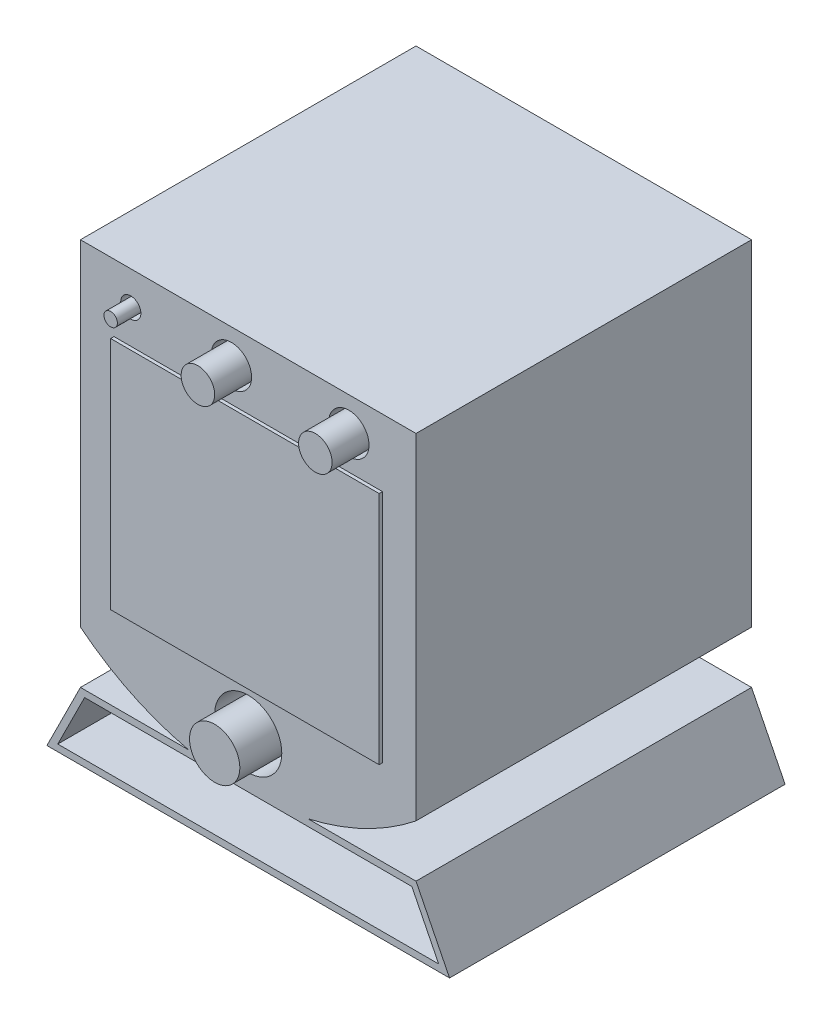
from build123d import *

# Parameters (mm, degrees)
EXTRUDE_1_DEPTH     = 50
EXTRUDE_1_2_DEPTH   = 50
SKETCH_3_W          = 80
SKETCH_3_H          = 70
EXTRUDE_2_DEPTH     = 1
SKETCH_4_R          = 3
SKETCH_4_R_2        = 6
SKETCH_4_R_3        = 10
CUT_EXTRUDE_1_DEPTH = 10
SKETCH_5_R          = 7.5
SKETCH_5_R_2        = 5
EXTRUDE_3_DEPTH     = 20
SKETCH_6_R          = 2
EXTRUDE_4_DEPTH     = 16


with BuildPart() as part:
    # 草图1 → Extrude 1 (new, symmetric)
    with BuildSketch(Plane.XY):
        Polygon((-50, 10.796505179), (50, 10.796505179), (60, -9.203494821), (-60, -9.203494821), align=None)
        Polygon((-48.763932023, 8.796505179), (48.763932023, 8.796505179), (56.763932023, -7.203494821), (-56.763932023, -7.203494821), align=None, mode=Mode.SUBTRACT)
    extrude(amount=EXTRUDE_1_DEPTH, both=True)

    # 草图2 → Extrude 1 2 (add, symmetric)
    with BuildSketch(Plane.XY):
        with BuildLine():
            Line((50, 26.346525195), (50, 126.346525195))
            Line((50, 126.346525195), (-50, 126.346525195))
            Line((-50, 126.346525195), (-50, 26.346525195))
            ThreePointArc((-50, 26.346525195), (0, 8.796505179), (50, 26.346525195))
        make_face()
    extrude(amount=EXTRUDE_1_2_DEPTH, both=True)

    # 草图3 → 凸台-拉伸2 (add)
    with BuildSketch(Plane.XY.offset(50)):
        with Locations((0, 71.346525195)):
            Rectangle(SKETCH_3_W, SKETCH_3_H)
    extrude(amount=EXTRUDE_2_DEPTH)

    # 草图4 → 切除-拉伸1 (cut)
    with BuildSketch(Plane.XY.offset(50)):
        with Locations((-35, 116.346525195)):
            Circle(SKETCH_4_R)
        with Locations((-5, 116.346525195)):
            Circle(SKETCH_4_R_2)
        with Locations((30, 116.346525195)):
            Circle(SKETCH_4_R_2)
        with Locations((0, 23.796505179)):
            Circle(SKETCH_4_R_3)
    extrude(amount=-CUT_EXTRUDE_1_DEPTH, mode=Mode.SUBTRACT)

    # 草图5 → 凸台-拉伸3 (add)
    with BuildSketch(Plane.XY.offset(40)):
        with Locations((0, 23.796505179)):
            Circle(SKETCH_5_R)
        with Locations((-5, 116.346525195)):
            Circle(SKETCH_5_R_2)
        with Locations((30, 116.346525195)):
            Circle(SKETCH_5_R_2)
    extrude(amount=EXTRUDE_3_DEPTH)

    # 草图6 → 凸台-拉伸4 (add)
    with BuildSketch(Plane.XY.offset(40)):
        with Locations((-35, 116.346525195)):
            Circle(SKETCH_6_R)
    extrude(amount=EXTRUDE_4_DEPTH)


solid = part.part
